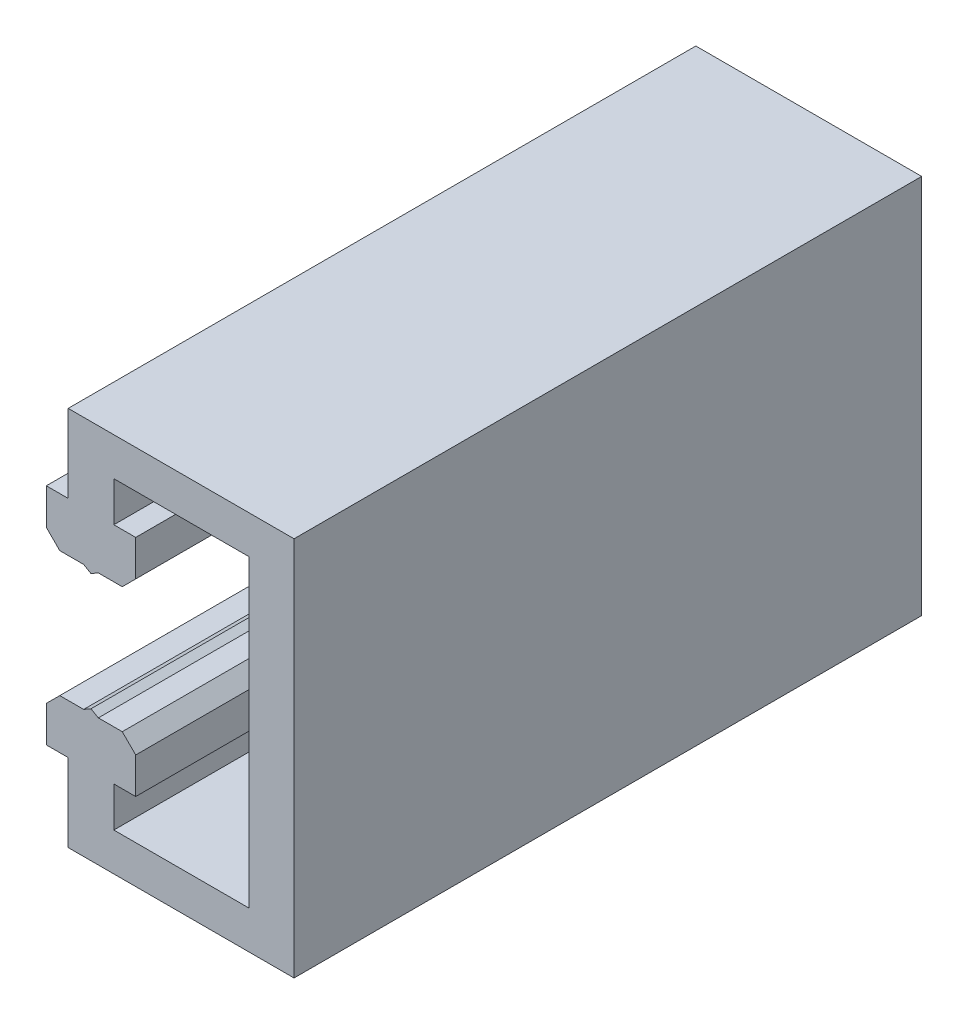
from build123d import *

# Parameters (mm, degrees)
BOSS_EXTRUDE1_DEPTH = 33


with BuildPart() as part:
    # Sketch3 → Boss-Extrude1 (new body)
    with BuildSketch(Plane.XY):
        Polygon((1253.633022308, 553.942382336), (1265.508055687, 553.942382336), (1265.508055687, 533.942401409), (1253.633022308, 533.942401409), (1253.633022308, 538.042366505), (1252.483010292, 538.042366505), (1252.483010292, 539.935290813), (1253.190159798, 540.642380714), (1254.447460175, 540.642380714), (1254.833102226, 540.865063667), (1255.218744278, 540.642380714), (1256.475925446, 540.642380714), (1257.183074951, 539.935290813), (1257.183074951, 538.042366505), (1256.033062935, 538.042366505), (1256.033062935, 535.94237566), (1263.126850128, 535.94237566), (1263.126850128, 551.942408085), (1256.033062935, 551.942408085), (1256.033062935, 549.84241724), (1257.183074951, 549.84241724), (1257.183074951, 547.949492931), (1256.475925446, 547.24240303), (1255.218744278, 547.24240303), (1254.833102226, 547.019720078), (1254.447460175, 547.24240303), (1253.190159798, 547.24240303), (1252.483010292, 547.949492931), (1252.483010292, 549.84241724), (1253.633022308, 549.84241724), align=None)
    extrude(amount=BOSS_EXTRUDE1_DEPTH)


solid = part.part
